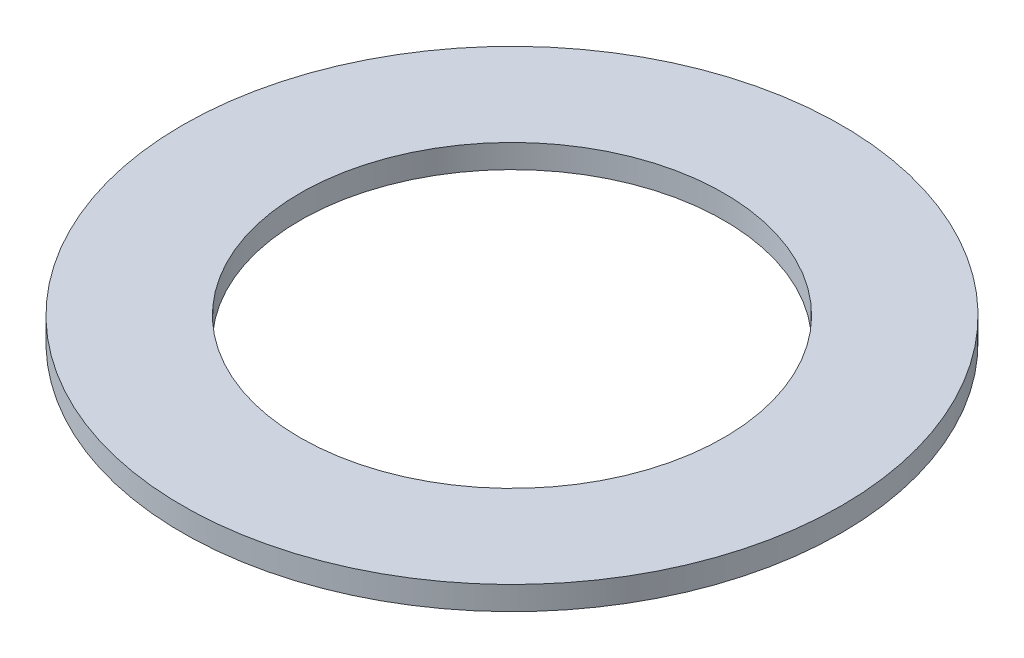
from build123d import *

# Parameters (mm, degrees)
SKETCH1_R           = 14
SKETCH1_R_2         = 9
EXTRUDE_THIN1_DEPTH = 1


with BuildPart() as part:
    # Sketch1 → Extrude-Thin1 (new body)
    with BuildSketch(Plane(origin=(0, 0, 0), x_dir=(1, 0, 0), z_dir=(0, 1, 0))):
        Circle(SKETCH1_R)
        Circle(SKETCH1_R_2, mode=Mode.SUBTRACT)
    extrude(amount=EXTRUDE_THIN1_DEPTH)


solid = part.part
